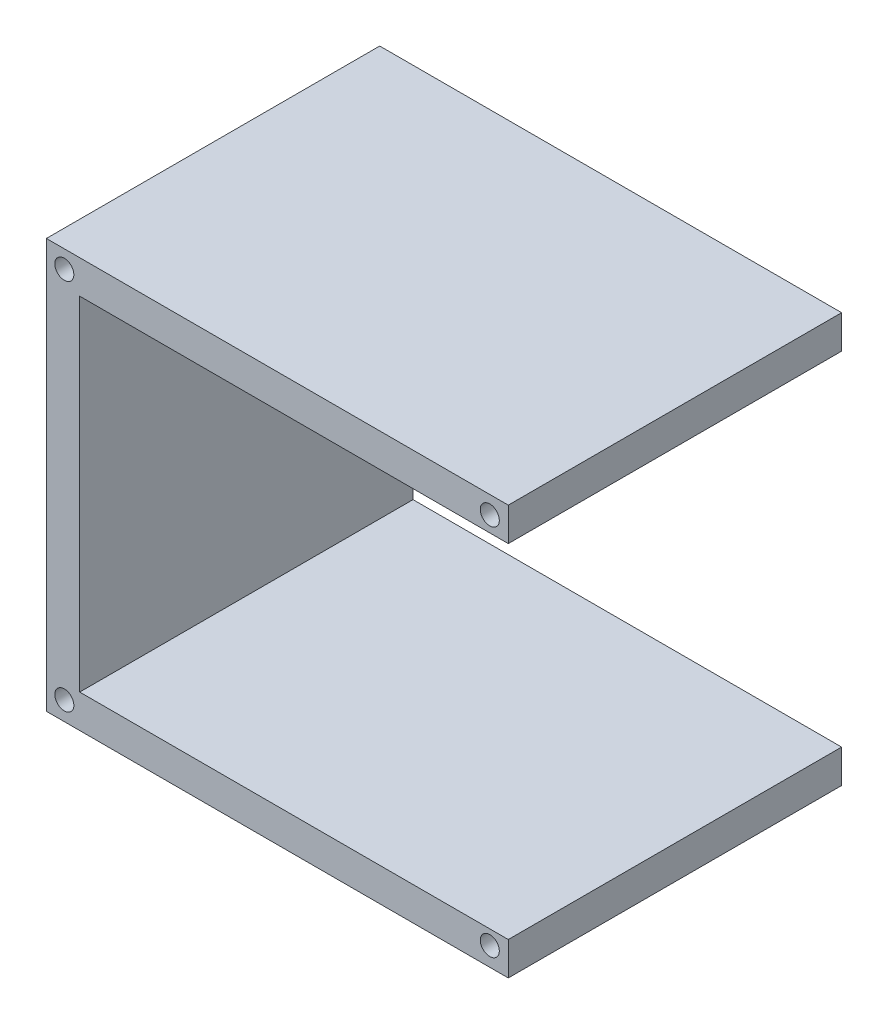
from build123d import *

# Parameters (mm, degrees)
BOSS_EXTRUDE1_DEPTH   = 35
F_2_0MM_DOWEL_HOLE1_D = 2


with BuildPart() as part:
    # Sketch2 → Boss-Extrude1 (new body)
    with BuildSketch(Plane.XY):
        Polygon((0, 0), (48.5, 0), (48.5, 3.5), (3.5, 3.5), (3.5, 39.5), (48.5, 39.5), (48.5, 43), (0, 43), align=None)
    extrude(amount=BOSS_EXTRUDE1_DEPTH)

    # Ø2.0mm Dowel Hole1 (through all)
    with Locations(Plane.XY.offset(35)):
        with Locations((46.557508768, 1.980929828), (1.882524811, 1.980929828), (1.882524811, 41.139003015), (46.557508768, 41.139003015)):
            Hole(F_2_0MM_DOWEL_HOLE1_D / 2)


solid = part.part
